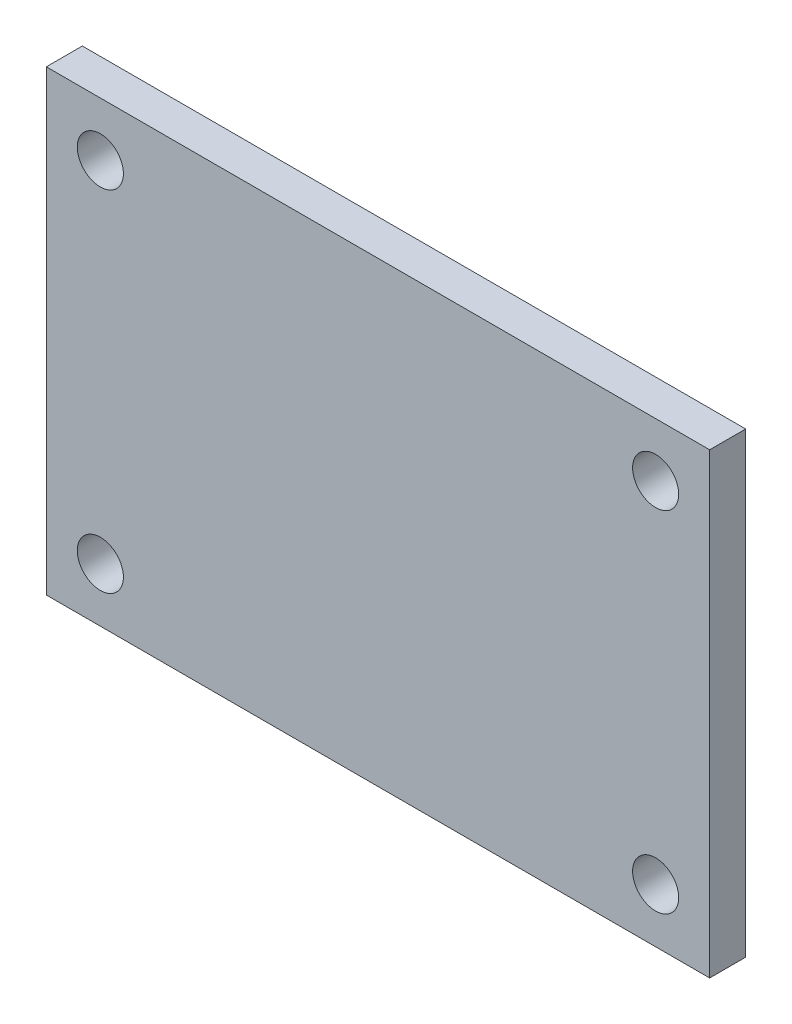
from build123d import *

# Parameters (mm, degrees)
ESQUISSE1_W        = 92.08
ESQUISSE1_H        = 63.5
ESQUISSE1_R        = 3.2
BOSS_EXTRU_1_DEPTH = 5


with BuildPart() as part:
    # Esquisse1 → Boss.-Extru.1 (new body)
    with BuildSketch(Plane.XY):
        with Locations((-46.04, -31.75)):
            Rectangle(ESQUISSE1_W, ESQUISSE1_H)
        with Locations((-84.58, -7.5)):
            Circle(ESQUISSE1_R, mode=Mode.SUBTRACT)
        with Locations((-7.5, -7.5)):
            Circle(ESQUISSE1_R, mode=Mode.SUBTRACT)
        with Locations((-7.5, -56)):
            Circle(ESQUISSE1_R, mode=Mode.SUBTRACT)
        with Locations((-84.58, -56)):
            Circle(ESQUISSE1_R, mode=Mode.SUBTRACT)
    extrude(amount=BOSS_EXTRU_1_DEPTH)


solid = part.part
